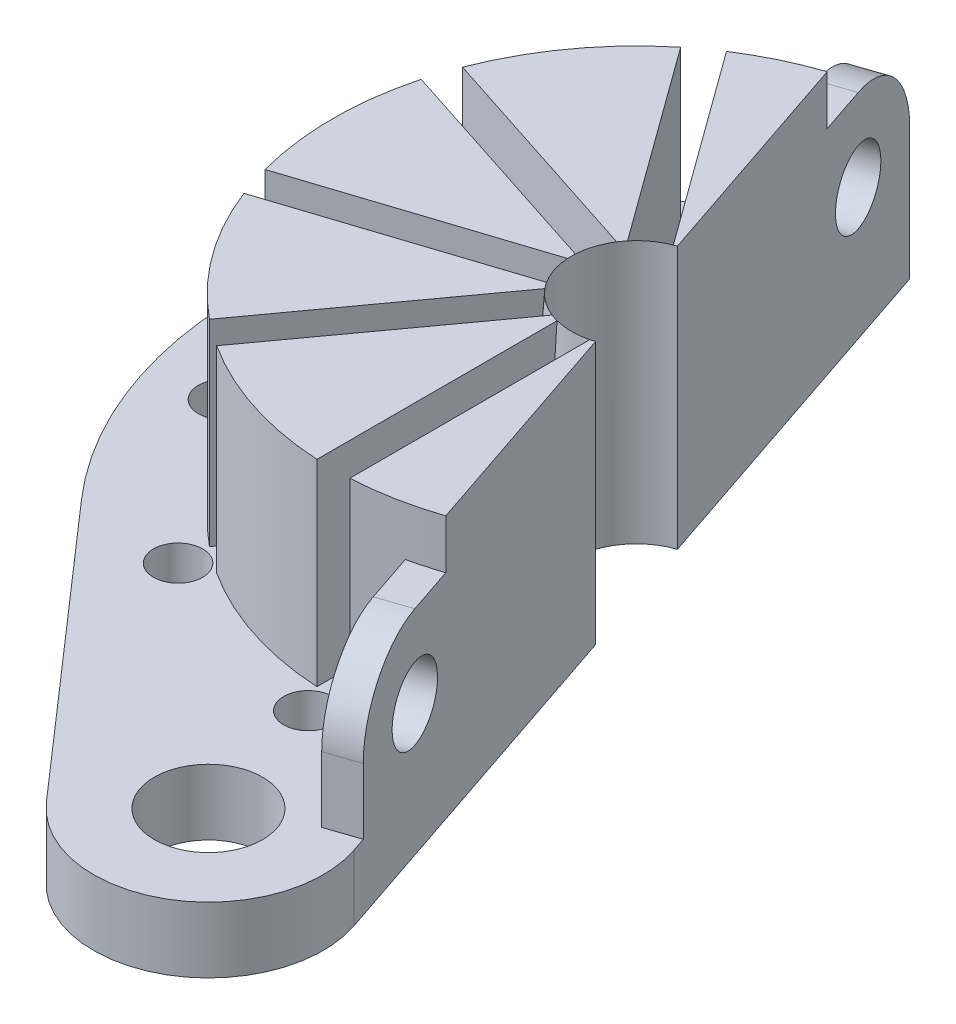
from build123d import *
from build123d.topology import SkipClean

# Parameters (mm, degrees)
SKETCH1_R           = 11.984375
SKETCH1_R_2         = 1.984375
SKETCH1_R_3         = 0.75
BOSS_EXTRUDE1_DEPTH = 2
SKETCH6_W           = 23.96875
SKETCH6_H           = 8
CUT_EXTRUDE1_DEPTH  = 19.741677841
BOSS_EXTRUDE3_START = -2
SKETCH7_R           = 1.65
BOSS_EXTRUDE3_DEPTH = 2
SKETCH8_R           = 1.1
BOSS_EXTRUDE4_DEPTH = 1


with BuildPart() as part:
    # Sketch1 → Boss-Extrude1 (new body)
    with BuildSketch(Plane(origin=(0, 0, 0), x_dir=(1, 0, 0), z_dir=(0, 1, 0))):
        with Locations(Location((0, 0, 0), (0, 0, 270))):
            Circle(SKETCH1_R)
        with Locations(Location((0, 0, 0), (0, 0, 270))):
            Circle(SKETCH1_R_2, mode=Mode.SUBTRACT)
        with Locations(Location((0, 10, 0), (0, 0, 270))):
            Circle(SKETCH1_R_3, mode=Mode.SUBTRACT)
        with Locations(Location((5.877852523, 8.090169944, 0), (0, 0, 270))):
            Circle(SKETCH1_R_3, mode=Mode.SUBTRACT)
        with Locations(Location((9.510565163, 3.090169944, 0), (0, 0, 270))):
            Circle(SKETCH1_R_3, mode=Mode.SUBTRACT)
        with Locations(Location((9.510565163, -3.090169944, 0), (0, 0, 270))):
            Circle(SKETCH1_R_3, mode=Mode.SUBTRACT)
        with Locations(Location((5.877852523, -8.090169944, 0), (0, 0, 270))):
            Circle(SKETCH1_R_3, mode=Mode.SUBTRACT)
        with Locations(Location((0, -10, 0), (0, 0, 270))):
            Circle(SKETCH1_R_3, mode=Mode.SUBTRACT)
        with Locations(Location((-5.877852523, -8.090169944, 0), (0, 0, 270))):
            Circle(SKETCH1_R_3, mode=Mode.SUBTRACT)
        with Locations(Location((-9.510565163, -3.090169944, 0), (0, 0, 270))):
            Circle(SKETCH1_R_3, mode=Mode.SUBTRACT)
        with Locations(Location((-9.510565163, 3.090169944, 0), (0, 0, 270))):
            Circle(SKETCH1_R_3, mode=Mode.SUBTRACT)
        with Locations(Location((-5.877852523, 8.090169944, 0), (0, 0, 270))):
            Circle(SKETCH1_R_3, mode=Mode.SUBTRACT)
    extrude(amount=BOSS_EXTRUDE1_DEPTH)

    # Sweep1: sweep along a path in Sketch3
    with SkipClean():  # the faces are left unmerged after this step: merging them gives an invalid solid
        with BuildLine(Plane(origin=(0, 0, 0), x_dir=(0, 0, -1), z_dir=(1, 0, 0))) as sweep1_path:
            Line((0, 2), (0, 8))
        # Sketch2 → Sweep1 (sweep)
        with BuildSketch(Plane(origin=(0, 2, 0), x_dir=(1, 0, 0), z_dir=(0, 1, 0))):
            with BuildLine():
                Line((-0.5, 9.236476601), (-0.5, 1.920350005))
                ThreePointArc((-0.5, 1.920350005), (-0.613205598, 1.887252775), (-0.724244915, 1.847488415))
                Line((-0.724244915, 1.847488415), (-5.024556232, 7.766359164))
                ThreePointArc((-5.024556232, 7.766359164), (-2.858407198, 8.797272776), (-0.5, 9.236476601))
            make_face()
            with BuildLine():
                Line((0.5, 9.236476601), (0.5, 1.920350005))
                ThreePointArc((0.5, 1.920350005), (0.613205598, 1.887252775), (0.724244915, 1.847488415))
                Line((0.724244915, 1.847488415), (5.024556232, 7.766359164))
                ThreePointArc((5.024556232, 7.766359164), (2.858407198, 8.797272776), (0.5, 9.236476601))
            make_face()
            with BuildLine():
                Line((5.833573226, 7.178573912), (1.533261909, 1.259703163))
                ThreePointArc((1.533261909, 1.259703163), (1.605393098, 1.16638636), (1.671852888, 1.068949045))
                Line((1.671852888, 1.068949045), (8.629902762, 3.329756496))
                ThreePointArc((8.629902762, 3.329756496), (7.483407198, 5.437013584), (5.833573226, 7.178573912))
            make_face()
            with BuildLine():
                Line((8.938919756, 2.37869998), (1.980869883, 0.117892528))
                ThreePointArc((1.980869883, 0.117892528), (1.984375, 0), (1.980869883, -0.117892528))
                Line((1.980869883, -0.117892528), (8.938919756, -2.37869998))
                ThreePointArc((8.938919756, -2.37869998), (9.25, 0), (8.938919756, 2.37869998))
            make_face()
            with BuildLine():
                Line((8.629902762, -3.329756496), (1.671852888, -1.068949045))
                ThreePointArc((1.671852888, -1.068949045), (1.605393098, -1.16638636), (1.533261909, -1.259703163))
                Line((1.533261909, -1.259703163), (5.833573226, -7.178573912))
                ThreePointArc((5.833573226, -7.178573912), (7.483407198, -5.437013584), (8.629902762, -3.329756496))
            make_face()
            with BuildLine():
                Line((5.024556232, -7.766359164), (0.724244915, -1.847488415))
                ThreePointArc((0.724244915, -1.847488415), (0.613205598, -1.887252775), (0.5, -1.920350005))
                Line((0.5, -1.920350005), (0.5, -9.236476601))
                ThreePointArc((0.5, -9.236476601), (2.858407198, -8.797272776), (5.024556232, -7.766359164))
            make_face()
            with BuildLine():
                Line((-0.5, -9.236476601), (-0.5, -1.920350005))
                ThreePointArc((-0.5, -1.920350005), (-0.613205598, -1.887252775), (-0.724244915, -1.847488415))
                Line((-0.724244915, -1.847488415), (-5.024556232, -7.766359164))
                ThreePointArc((-5.024556232, -7.766359164), (-2.858407198, -8.797272776), (-0.5, -9.236476601))
            make_face()
            with BuildLine():
                Line((-5.833573226, -7.178573912), (-1.533261909, -1.259703163))
                ThreePointArc((-1.533261909, -1.259703163), (-1.605393098, -1.16638636), (-1.671852888, -1.068949045))
                Line((-1.671852888, -1.068949045), (-8.629902762, -3.329756496))
                ThreePointArc((-8.629902762, -3.329756496), (-7.483407198, -5.437013584), (-5.833573226, -7.178573912))
            make_face()
            with BuildLine():
                Line((-8.938919756, -2.37869998), (-1.980869883, -0.117892528))
                ThreePointArc((-1.980869883, -0.117892528), (-1.984375, 0), (-1.980869883, 0.117892528))
                Line((-1.980869883, 0.117892528), (-8.938919756, 2.37869998))
                ThreePointArc((-8.938919756, 2.37869998), (-9.25, 0), (-8.938919756, -2.37869998))
            make_face()
            with BuildLine():
                Line((-8.629902762, 3.329756496), (-1.671852888, 1.068949045))
                ThreePointArc((-1.671852888, 1.068949045), (-1.605393098, 1.16638636), (-1.533261909, 1.259703163))
                Line((-1.533261909, 1.259703163), (-5.833573226, 7.178573912))
                ThreePointArc((-5.833573226, 7.178573912), (-7.483407198, 5.437013584), (-8.629902762, 3.329756496))
            make_face()
        sweep(path=sweep1_path.line)

    # Sketch4 → Revolve1 (revolve)
    with SkipClean():  # the faces are left unmerged after this step: merging them gives an invalid solid
        with BuildSketch(Plane(origin=(0, 0, 0), x_dir=(0, 0, -1), z_dir=(1, 0, 0)), mode=Mode.PRIVATE) as revolve1_sk:
            Polygon((-2.37869998, 2), (-1.984375, 2), (-1.984375, 8), align=None)
        revolve(revolve1_sk.sketch.rotate(Axis((0, 0, 0), (0, 1, 0)), 165.405971265), axis=Axis((0, 0, 0), (0, 1, 0)))

    # Sketch6 → Cut-Extrude1 (cut, through all)
    with SkipClean():  # the faces are left unmerged after this step: merging them gives an invalid solid
        with BuildSketch(Plane(origin=(0, 0, 0), x_dir=(-0.3193728209047868, 0, -0.9476291475399641), z_dir=(-0.9476291475399641, 0, 0.3193728209047868))):
            with Locations((0, -4)):
                Rectangle(SKETCH6_W, SKETCH6_H)
        extrude(amount=-CUT_EXTRUDE1_DEPTH, mode=Mode.SUBTRACT)

    # Sketch7 → Boss-Extrude3 (add)
    with SkipClean():  # the faces are left unmerged after this step: merging them gives an invalid solid
        with BuildSketch(Plane(origin=(0, 2, 0), x_dir=(1, 0, 0), z_dir=(0, 1, 0)).offset(BOSS_EXTRUDE3_START)):
            with BuildLine():
                Line((-9.021857716, -7.888683508), (-1.576209535, -16.403865848))
                ThreePointArc((-1.576209535, -16.403865848), (2.803074288, -17.134270389), (4.375298385, -12.982195127))
                Line((4.375298385, -12.982195127), (3.827483651, -11.356743065))
                ThreePointArc((3.827483651, -11.356743065), (-3.122857627, -11.570350227), (-9.021857716, -7.888683508))
            make_face()
            with Locations(Location((1.058596369, -14.1, 0), (0, 0, 270))):
                Circle(SKETCH7_R, mode=Mode.SUBTRACT)
        extrude(amount=BOSS_EXTRUDE3_DEPTH)

    # Sketch8 → Boss-Extrude4 (add)
    # profile 1 of 2: a face of its own
    with SkipClean():  # the faces are left unmerged after this step: merging them gives an invalid solid
        with BuildSketch(Plane(origin=(0, 0, 0), x_dir=(-0.31937282090478675, 0, -0.9476291475399641), z_dir=(0.9476291475399641, 0, -0.31937282090478675))):
            with BuildLine():
                Line((-13.25, 4), (-13.25, 2))
                Line((-13.25, 2), (-8.75, 2))
                Line((-8.75, 2), (-8.75, 6.5))
                Line((-8.75, 6.5), (-9.25, 6.5))
                Line((-9.25, 6.5), (-10.75, 6.5))
                ThreePointArc((-10.75, 6.5), (-12.517766953, 5.767766953), (-13.25, 4))
            make_face()
            with Locations((-10.75, 4)):
                Circle(SKETCH8_R, mode=Mode.SUBTRACT)
        # profile 2 of 2: a face of its own
        with BuildSketch(Plane(origin=(0, 0, 0), x_dir=(-0.31937282090478675, 0, -0.9476291475399641), z_dir=(0.9476291475399641, 0, -0.31937282090478675))):
            with BuildLine():
                Line((11.484375, 2), (8.75, 2))
                Line((8.75, 2), (8.75, 6.5))
                Line((8.75, 6.5), (9.25, 6.5))
                Line((9.25, 6.5), (10.75, 6.5))
                ThreePointArc((10.75, 6.5), (12.517766953, 5.767766953), (13.25, 4))
                Line((13.25, 4), (13.25, 2))
                Line((13.25, 2), (13.25, 0))
                Line((13.25, 0), (11.984375, 0))
                Line((11.984375, 0), (11.484375, 0))
                Line((11.484375, 0), (11.484375, 2))
            make_face()
            with Locations((10.75, 4)):
                Circle(SKETCH8_R, mode=Mode.SUBTRACT)
        extrude(amount=-BOSS_EXTRUDE4_DEPTH)


solid = part.part
